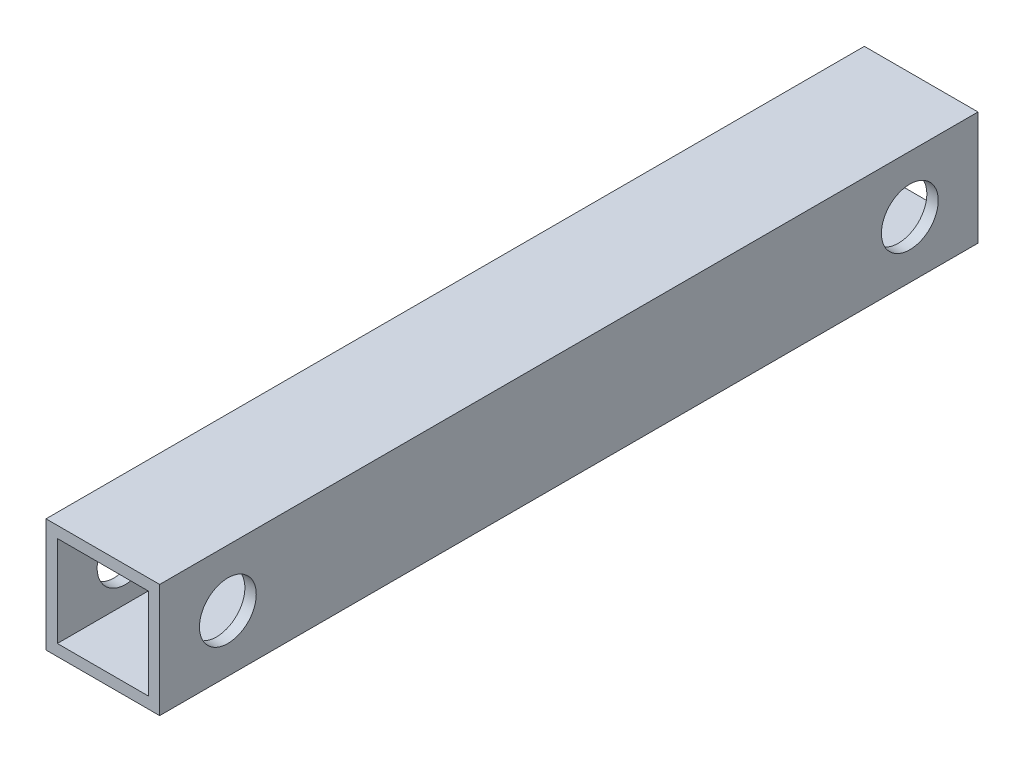
from build123d import *

# Parameters (mm, degrees)
SKETCH1_W           = 50
SKETCH1_H           = 50
SKETCH1_W_2         = 40
SKETCH1_H_2         = 40
BOSS_EXTRUDE1_DEPTH = 360
SKETCH2_R           = 12.5
CUT_EXTRUDE1_DEPTH  = 300


with BuildPart() as part:
    # Sketch1 → Boss-Extrude1 (new body)
    with BuildSketch(Plane.XY):
        Rectangle(SKETCH1_W, SKETCH1_H)
        Rectangle(SKETCH1_W_2, SKETCH1_H_2, mode=Mode.SUBTRACT)
    extrude(amount=BOSS_EXTRUDE1_DEPTH)

    # Sketch2 → Cut-Extrude1 (cut)
    with BuildSketch(Plane(origin=(25, 0, 0), x_dir=(0, 0, -1), z_dir=(1, 0, 0))):
        with Locations((-330, 0)):
            Circle(SKETCH2_R)
        with Locations((-30, 0)):
            Circle(SKETCH2_R)
    extrude(amount=-CUT_EXTRUDE1_DEPTH, mode=Mode.SUBTRACT)


solid = part.part
